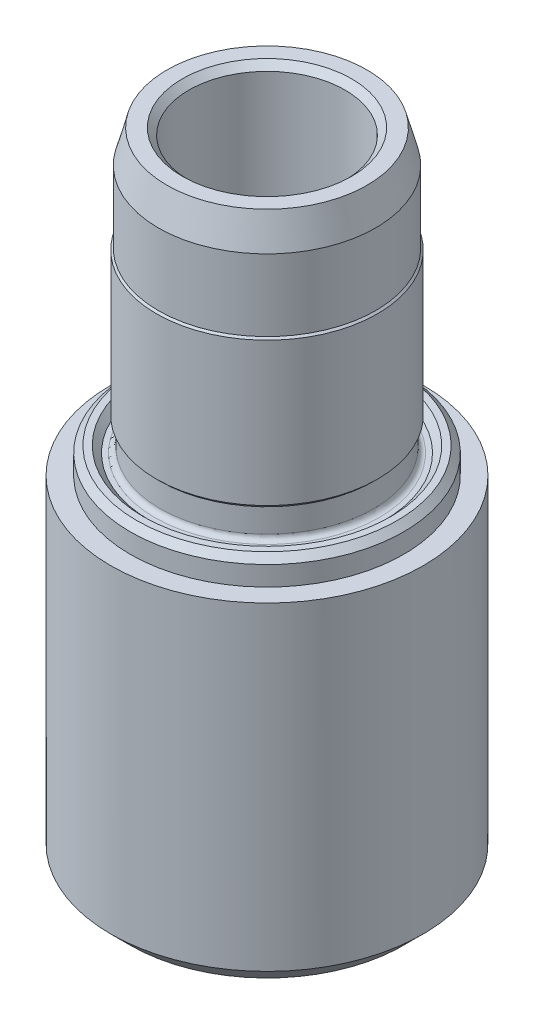
from build123d import *

# Parameters (mm, degrees)
PER_AGE_T_TE_D           = 12
PER_AGE_T_TE_DEPTH       = 20
PER_AGE_T_TE_CSINK_D     = 15
PER_AGE_T_TE_CSINK_ANGLE = 90
PER_AGE_T_TE_TIP         = 3.605163714
H_XAGONE_DEPTH           = 12
CENTRAGE_D               = 3
CENTRAGE_DEPTH           = 6
CENTRAGE_CSINK_D         = 5
CENTRAGE_CSINK_ANGLE     = 60
CENTRAGE_TIP             = 0.901290929
PER_AGE_AXE_D            = 12
PER_AGE_AXE_DEPTH        = 12
PER_AGE_AXE_CSINK_D      = 13
PER_AGE_AXE_CSINK_ANGLE  = 90
PER_AGE_AXE_TIP          = 3.605163714
ESQUISSE9_W              = 7
ESQUISSE9_H              = 8.5
ESQUISSE9_W_2            = 1.5
ESQUISSE9_H_2            = 2
ESQUISSE10_W             = 2
ESQUISSE10_H             = 8.5
CHANFREIN1_SIZE          = 1.5


with BuildPart() as part:
    # Esquisse1 → Base-Révolution (revolve)
    with BuildSketch(Plane.XY, mode=Mode.PRIVATE) as base_r_volution_sk:
        with BuildLine():
            Line((0, 0), (7.680127019, 0))
            Line((7.680127019, 0), (8.35, -2.5))
            Line((8.35, -2.5), (8.35, -8))
            Line((8.35, -8), (8.49, -8.14))
            Line((8.49, -8.14), (8.49, -19.14))
            Line((8.49, -19.14), (8.21, -19.42))
            Line((8.21, -19.42), (8.21, -21.24))
            ThreePointArc((8.21, -21.24), (8.327157288, -21.522842712), (8.61, -21.64))
            Line((8.61, -21.64), (8.99, -21.64))
            Line((8.99, -21.64), (9.49, -21.14))
            Line((9.49, -21.14), (10, -21.14))
            Line((10, -21.14), (12, -23.14))
            Line((12, -23.14), (12, -40.64))
            Line((12, -40.64), (10, -42.64))
            Line((10, -42.64), (10, -43.14))
            ThreePointArc((10, -43.14), (10.292893219, -43.847106781), (11, -44.14))
            Line((11, -44.14), (19, -44.14))
            Line((19, -44.14), (19, -45.14))
            Line((19, -45.14), (12.07179677, -49.14))
            Line((12.07179677, -49.14), (0, -49.14))
            Line((0, -49.14), (0, 0))
        make_face()
    revolve(base_r_volution_sk.sketch.rotate(Axis((0, -10, 0), (0, -1, 0)), 90), axis=Axis((0, -10, 0), (0, -1, 0)))

    # Perçage tête
    with Locations(Plane.XZ.offset(49.14)):
        with Locations((0, 0)):
            CounterSinkHole(PER_AGE_T_TE_D / 2, PER_AGE_T_TE_CSINK_D / 2, depth=PER_AGE_T_TE_DEPTH, counter_sink_angle=PER_AGE_T_TE_CSINK_ANGLE)
            with Locations((0, 0, -(PER_AGE_T_TE_DEPTH + PER_AGE_T_TE_TIP / 2))):  # 118° drill point
                Cone(0, PER_AGE_T_TE_D / 2, PER_AGE_T_TE_TIP, mode=Mode.SUBTRACT)

    # Esquisse4 → Héxagone (cut)
    with BuildSketch(Plane.XZ.offset(49.14)):
        with BuildLine():
            Line((-0.25, 6.783865663), (-5.75, 3.608439182))
            ThreePointArc((-5.75, 3.608439182), (-5.933012702, 3.425426481), (-6, 3.175426481))
            Line((-6, 3.175426481), (-6, -3.175426481))
            ThreePointArc((-6, -3.175426481), (-5.933012702, -3.425426481), (-5.75, -3.608439182))
            Line((-5.75, -3.608439182), (-0.25, -6.783865663))
            ThreePointArc((-0.25, -6.783865663), (0, -6.850852961), (0.25, -6.783865663))
            Line((0.25, -6.783865663), (5.75, -3.608439182))
            ThreePointArc((5.75, -3.608439182), (5.933012702, -3.425426481), (6, -3.175426481))
            Line((6, -3.175426481), (6, 3.175426481))
            ThreePointArc((6, 3.175426481), (5.933012702, 3.425426481), (5.75, 3.608439182))
            Line((5.75, 3.608439182), (0.25, 6.783865663))
            ThreePointArc((0.25, 6.783865663), (0, 6.850852961), (-0.25, 6.783865663))
        make_face()
    extrude(amount=-H_XAGONE_DEPTH, mode=Mode.SUBTRACT)

    # Centrage
    with Locations(Plane(origin=(0, 0, 0), x_dir=(-1, 0, 0), z_dir=(0, 1, 0))):
        with Locations((0, 0)):
            CounterSinkHole(CENTRAGE_D / 2, CENTRAGE_CSINK_D / 2, depth=CENTRAGE_DEPTH, counter_sink_angle=CENTRAGE_CSINK_ANGLE)
            with Locations((0, 0, -(CENTRAGE_DEPTH + CENTRAGE_TIP / 2))):  # 118° drill point
                Cone(0, CENTRAGE_D / 2, CENTRAGE_TIP, mode=Mode.SUBTRACT)

    # Perçage axe
    with Locations(Plane(origin=(0, 0, 0), x_dir=(-1, 0, 0), z_dir=(0, 1, 0))):
        with Locations((0, 0)):
            CounterSinkHole(PER_AGE_AXE_D / 2, PER_AGE_AXE_CSINK_D / 2, depth=PER_AGE_AXE_DEPTH, counter_sink_angle=PER_AGE_AXE_CSINK_ANGLE)
            with Locations((0, 0, -(PER_AGE_AXE_DEPTH + PER_AGE_AXE_TIP / 2))):  # 118° drill point
                Cone(0, PER_AGE_AXE_D / 2, PER_AGE_AXE_TIP, mode=Mode.SUBTRACT)

    # Esquisse9 → Enlèvement tête (revolve, cut)
    with BuildSketch(Plane.XY, mode=Mode.PRIVATE) as enl_vement_t_te_sk:
        with Locations((15.5, -44.89)):
            Rectangle(ESQUISSE9_W, ESQUISSE9_H)
        with Locations((11.25, -22.14)):
            Rectangle(ESQUISSE9_W_2, ESQUISSE9_H_2)
    revolve(enl_vement_t_te_sk.sketch.rotate(Axis((0, -50, 0), (0, 1, 0)), 90), axis=Axis((0, -50, 0), (0, 1, 0)), mode=Mode.SUBTRACT)

    # Esquisse10 → Suppression gorge (revolve)
    with BuildSketch(Plane.XY, mode=Mode.PRIVATE) as suppression_gorge_sk:
        with Locations((11, -44.89)):
            Rectangle(ESQUISSE10_W, ESQUISSE10_H)
    revolve(suppression_gorge_sk.sketch.rotate(Axis((0, -47.996933622, 0), (0, 1, 0)), 90), axis=Axis((0, -47.996933622, 0), (0, 1, 0)))

    # Chanfrein1
    chanfrein1_edges = [part.edges().sort_by_distance(p)[0] for p in [
        (0, -49.14, 12),
    ]]
    chamfer(chanfrein1_edges, length=CHANFREIN1_SIZE)


solid = part.part
